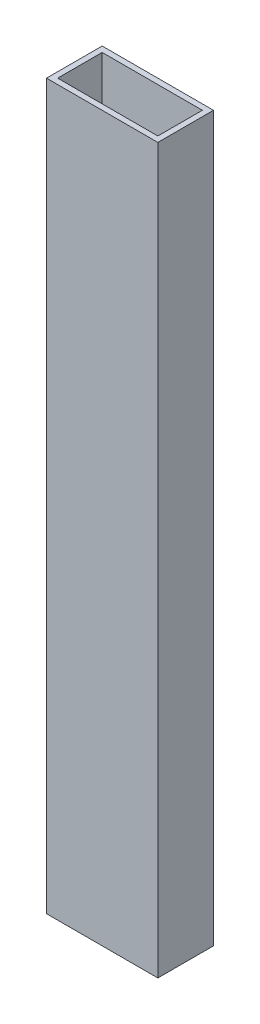
from build123d import *

# Parameters (mm, degrees)
SKETCH1_W           = 50.8
SKETCH1_H           = 25.4
SKETCH1_W_2         = 45.72
SKETCH1_H_2         = 20.32
EXTRUDE_THIN1_DEPTH = 330.2


with BuildPart() as part:
    # Sketch1 → Extrude-Thin1 (new body)
    with BuildSketch(Plane(origin=(0, 0, 0), x_dir=(1, 0, 0), z_dir=(0, 1, 0))):
        with Locations((-25.4, 12.7)):
            Rectangle(SKETCH1_W, SKETCH1_H)
        with Locations((-25.4, 12.7)):
            Rectangle(SKETCH1_W_2, SKETCH1_H_2, mode=Mode.SUBTRACT)
    extrude(amount=EXTRUDE_THIN1_DEPTH)


solid = part.part
